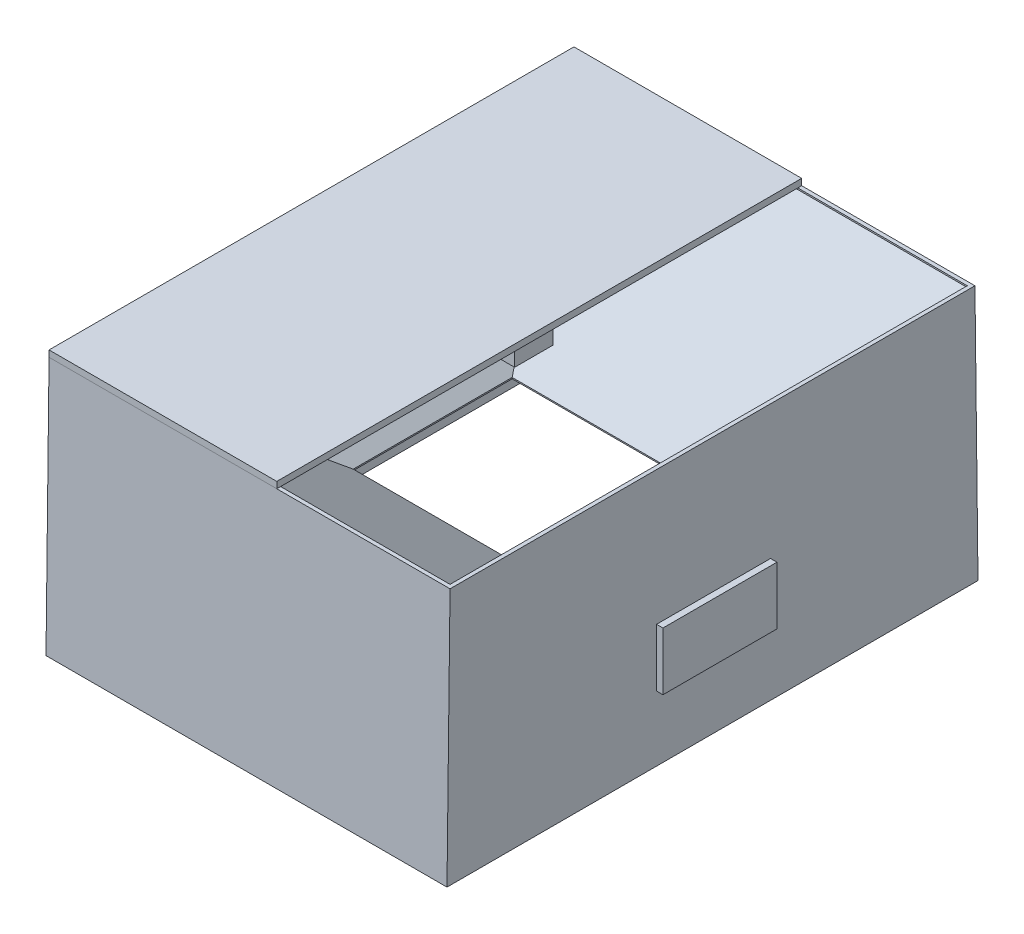
from build123d import *

# Parameters (mm, degrees)
VACIADO1_T              = -2
CROQUIS3_W              = 248.262637596
CROQUIS3_H              = 248.732155532
CORTAR_EXTRUIR1_DEPTH   = 10
VACIADO2_T              = -2
VACIADO5_T              = 2
CROQUIS6_W              = 623.6
CROQUIS6_H              = 827.1
CORTAR_EXTRUIR2_DEPTH   = 2
CROQUIS9_W              = 178.367282363
CROQUIS9_H              = 90.471612025
SALIENTE_EXTRUIR3_DEPTH = 10
CROQUIS8_W              = 356.413576815
CROQUIS8_H              = 821.552782022
SALIENTE_EXTRUIR2_DEPTH = 10
CROQUIS10_W             = 21.259263029
CROQUIS10_H             = 60.045937856
SALIENTE_EXTRUIR4_DEPTH = 30


with BuildPart() as part:
    # Croquis2 → Recubrir1 section 0
    with BuildSketch(Plane(origin=(0, 200, 0), x_dir=(1, 0, 0), z_dir=(0, 1, 0))):
        with BuildLine():
            Line((-311.8, 408.8), (311.8, 408.8))
            Line((311.8, 408.8), (311.8, -408.8))
            Line((311.8, -408.8), (-311.8, -408.8))
            Line((-311.8, -408.8), (-311.8, 408.8))
        make_face()
    # Croquis1 → Recubrir1 section 1
    with BuildSketch(Plane(origin=(0, 0, 0), x_dir=(1, 0, 0), z_dir=(0, 1, 0))):
        with BuildLine():
            Line((-125, 125), (125, 125))
            Line((125, 125), (125, -125))
            Line((125, -125), (-125, -125))
            Line((-125, -125), (-125, 125))
        make_face()
    loft()

    # Vaciado1
    vaciado1_openings = [part.faces().sort_by_distance(p)[0] for p in [
        (0, 200, 0),
    ]]
    offset(amount=VACIADO1_T, openings=vaciado1_openings, kind=Kind.INTERSECTION)

    # Croquis3 → Cortar-Extruir1 (cut)
    with BuildSketch(Plane(origin=(0, 2, 0), x_dir=(1, 0, 0), z_dir=(0, 1, 0))):
        Rectangle(CROQUIS3_W, CROQUIS3_H)
    extrude(amount=-CORTAR_EXTRUIR1_DEPTH, mode=Mode.SUBTRACT)



with BuildPart() as body_2:
    # Croquis4 → Recubrir3 section 0
    with BuildSketch(Plane(origin=(0, -200, 0), x_dir=(1, 0, 0), z_dir=(0, 1, 0))):
        with BuildLine():
            Line((-311.8, 413.55), (311.8, 413.55))
            Line((311.8, 413.55), (311.8, -413.55))
            Line((311.8, -413.55), (-311.8, -413.55))
            Line((-311.8, -413.55), (-311.8, 413.55))
        make_face()
    # Croquis5 → Recubrir3 section 1
    with BuildSketch(Plane(origin=(0, 200, 0), x_dir=(1, 0, 0), z_dir=(0, 1, 0))):
        with BuildLine():
            Line((-311.8, 408.8), (311.8, 408.8))
            Line((311.8, 408.8), (311.8, -408.8))
            Line((311.8, -408.8), (-311.8, -408.8))
            Line((-311.8, -408.8), (-311.8, 408.8))
        make_face()
    loft()

    # Vaciado2
    vaciado2_openings = [body_2.faces().sort_by_distance(p)[0] for p in [
        (0, 200, 0),
    ]]
    offset(amount=VACIADO2_T, openings=vaciado2_openings, kind=Kind.INTERSECTION)

    # Vaciado5
    vaciado5_openings = [body_2.faces().sort_by_distance(p)[0] for p in [
        (0, -200, 0),
    ]]
    offset(amount=VACIADO5_T, openings=vaciado5_openings, kind=Kind.INTERSECTION)

    # Croquis6 → Cortar-Extruir2 (cut)
    with BuildSketch(Plane.XZ.offset(198)):
        Rectangle(CROQUIS6_W, CROQUIS6_H)
    extrude(amount=-CORTAR_EXTRUIR2_DEPTH, mode=Mode.SUBTRACT)

    # Croquis9 → Saliente-Extruir3 (add)
    with BuildSketch(Plane(origin=(313.8, 0, 0), x_dir=(0, 0, -1), z_dir=(1, 0, 0))):
        with Locations((1.646006801, -52.973562953)):
            Rectangle(CROQUIS9_W, CROQUIS9_H)
    extrude(amount=SALIENTE_EXTRUIR3_DEPTH)

    # Croquis8 → Saliente-Extruir2 (add)
    with BuildSketch(Plane(origin=(0, 202, 0), x_dir=(1, 0, 0), z_dir=(0, 1, 0))):
        with Locations((-135.593211593, 0)):
            Rectangle(CROQUIS8_W, CROQUIS8_H)
    extrude(amount=SALIENTE_EXTRUIR2_DEPTH)


with BuildPart() as part_1:
    add(part.part)

    add(body_2.part)  # Saliente-Extruir4 merges body 2
    # Croquis10 → Saliente-Extruir4 (add)
    with BuildSketch(Plane.XZ.offset(-202)):
        with Locations((23.495977574, 0)):
            Rectangle(CROQUIS10_W, CROQUIS10_H)
    extrude(amount=SALIENTE_EXTRUIR4_DEPTH)


solid = part_1.part
